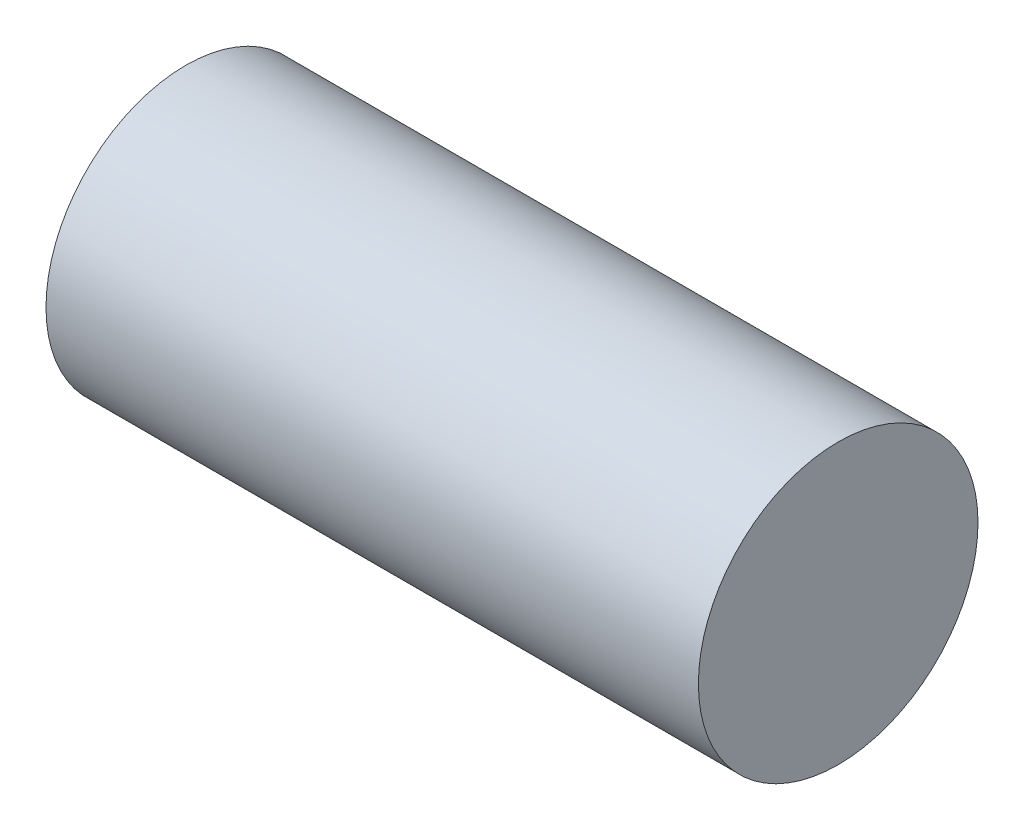
from build123d import *

# Parameters (mm, degrees)
SKETCH1_R           = 38.1
BOSS_EXTRUDE1_DEPTH = 177.8
SCALE1_SCALE        = 2.84


with BuildPart() as part:
    # Sketch1 → Boss-Extrude1 (new body)
    with BuildSketch(Plane(origin=(0, 0, 0), x_dir=(0, 0, -1), z_dir=(1, 0, 0))):
        Circle(SKETCH1_R)
    extrude(amount=BOSS_EXTRUDE1_DEPTH)


with BuildPart() as part_1:
    # Scale1: scaled about (88.9, 0, 0)
    add(part.part.scale(SCALE1_SCALE).moved(Location((-163.576, 0, 0))))


solid = part_1.part
